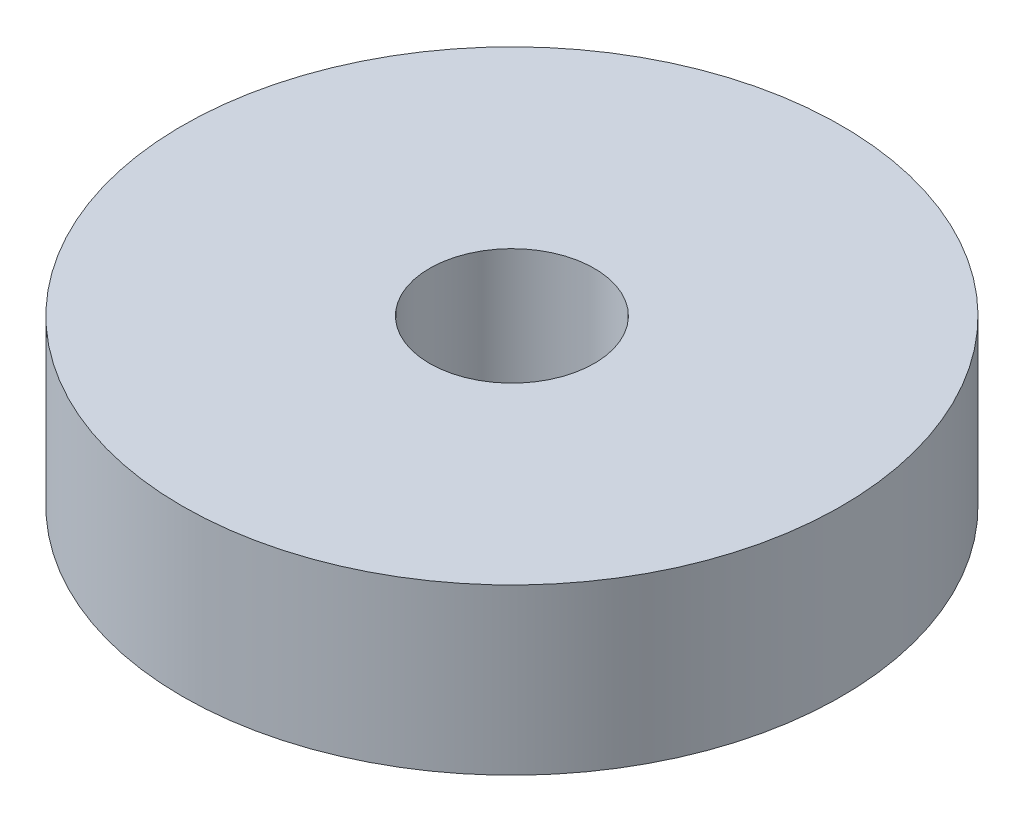
from build123d import *

# Parameters (mm, degrees)
SKETCH1_R           = 100
BOSS_EXTRUDE2_DEPTH = 50
SKETCH2_R           = 25
CUT_EXTRUDE1_DEPTH  = 50


with BuildPart() as part:
    # Sketch1 → Boss-Extrude2 (new body)
    with BuildSketch(Plane(origin=(0, 0, 0), x_dir=(1, 0, 0), z_dir=(0, 1, 0))):
        with Locations(Location((0, 0, 0), (0, 0, 270))):
            Circle(SKETCH1_R)
    extrude(amount=BOSS_EXTRUDE2_DEPTH)

    # Sketch2 → Cut-Extrude1 (cut)
    with BuildSketch(Plane(origin=(0, 50, 0), x_dir=(1, 0, 0), z_dir=(0, 1, 0))):
        with Locations(Location((0, 0, 0), (0, 0, 270))):
            Circle(SKETCH2_R)
    extrude(amount=-CUT_EXTRUDE1_DEPTH, mode=Mode.SUBTRACT)


solid = part.part
